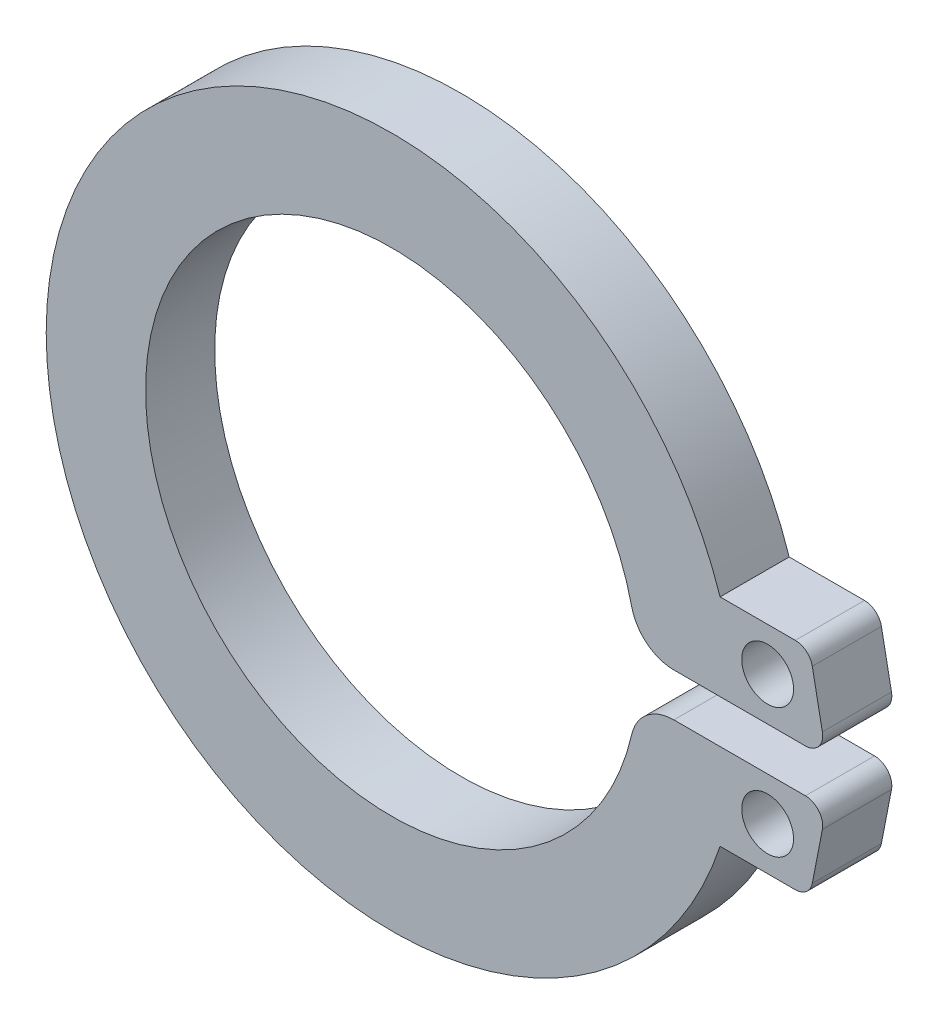
from build123d import *

# Parameters (mm, degrees)
SKETCH1_R           = 0.3
BOSS_EXTRUDE1_DEPTH = 0.4


with BuildPart() as part:
    # Sketch1 → Boss-Extrude1 (new, symmetric)
    with BuildSketch(Plane(origin=(0, 0, 0), x_dir=(0, 1, 0), z_dir=(0, 0, 1))):
        with BuildLine():
            Line((-0.25, -3.264965543), (-0.25, -4.787380599))
            ThreePointArc((-0.25, -4.787380599), (-0.322784356, -4.941705516), (-0.488161799, -4.983706036))
            Line((-0.488161799, -4.983706036), (-1.088161799, -4.86707785))
            ThreePointArc((-1.088161799, -4.86707785), (-1.204324917, -4.797968058), (-1.25, -4.670752414))
            Line((-1.25, -4.670752414), (-1.25, -3.799671038))
            ThreePointArc((-1.25, -3.799671038), (0, 4), (1.25, -3.799671038))
            Line((1.25, -3.799671038), (1.25, -4.670752414))
            ThreePointArc((1.25, -4.670752414), (1.204324917, -4.797968058), (1.088161799, -4.86707785))
            Line((1.088161799, -4.86707785), (0.488161799, -4.983706036))
            ThreePointArc((0.488161799, -4.983706036), (0.322784356, -4.941705516), (0.25, -4.787380599))
            Line((0.25, -4.787380599), (0.25, -3.264965543))
            ThreePointArc((0.25, -3.264965543), (0.358866935, -2.953493353), (0.638059701, -2.777657253))
            ThreePointArc((0.638059701, -2.777657253), (0, 2.85), (-0.638059701, -2.777657253))
            ThreePointArc((-0.638059701, -2.777657253), (-0.358866935, -2.953493353), (-0.25, -3.264965543))
        make_face()
        with Locations(Location((0.75, -4.35, 0), (0, 0, 270))):
            Circle(SKETCH1_R, mode=Mode.SUBTRACT)
        with Locations(Location((-0.75, -4.35, 0), (0, 0, 270))):
            Circle(SKETCH1_R, mode=Mode.SUBTRACT)
    extrude(amount=BOSS_EXTRUDE1_DEPTH, both=True)


solid = part.part
